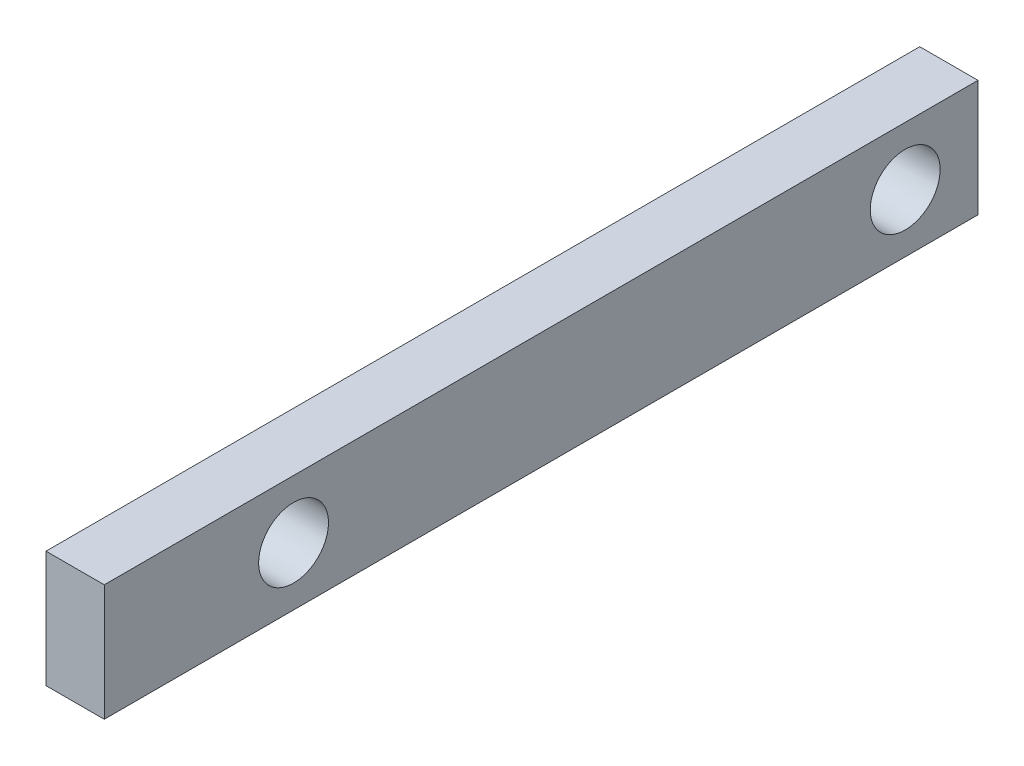
from build123d import *

# Parameters (mm, degrees)
SKETCH1_W           = 38.1
SKETCH1_H           = 5.08
BOSS_EXTRUDE1_DEPTH = 2.54
SKETCH2_R           = 1.524
CUT_EXTRUDE1_DEPTH  = 33.915859902


with BuildPart() as part:
    # Sketch1 → Boss-Extrude1 (new body)
    with BuildSketch(Plane(origin=(0, 0, 0), x_dir=(0, 0, -1), z_dir=(1, 0, 0))):
        with Locations((-13.60424, 0.73152)):
            Rectangle(SKETCH1_W, SKETCH1_H)
    extrude(amount=BOSS_EXTRUDE1_DEPTH)

    # Sketch2 → Cut-Extrude1 (cut, through all)
    with BuildSketch(Plane.ZY):
        with Locations((24.39924, 0.73152)):
            Circle(SKETCH2_R)
        with Locations((-2.27076, 0.73152)):
            Circle(SKETCH2_R)
    extrude(amount=-CUT_EXTRUDE1_DEPTH, mode=Mode.SUBTRACT)


solid = part.part
